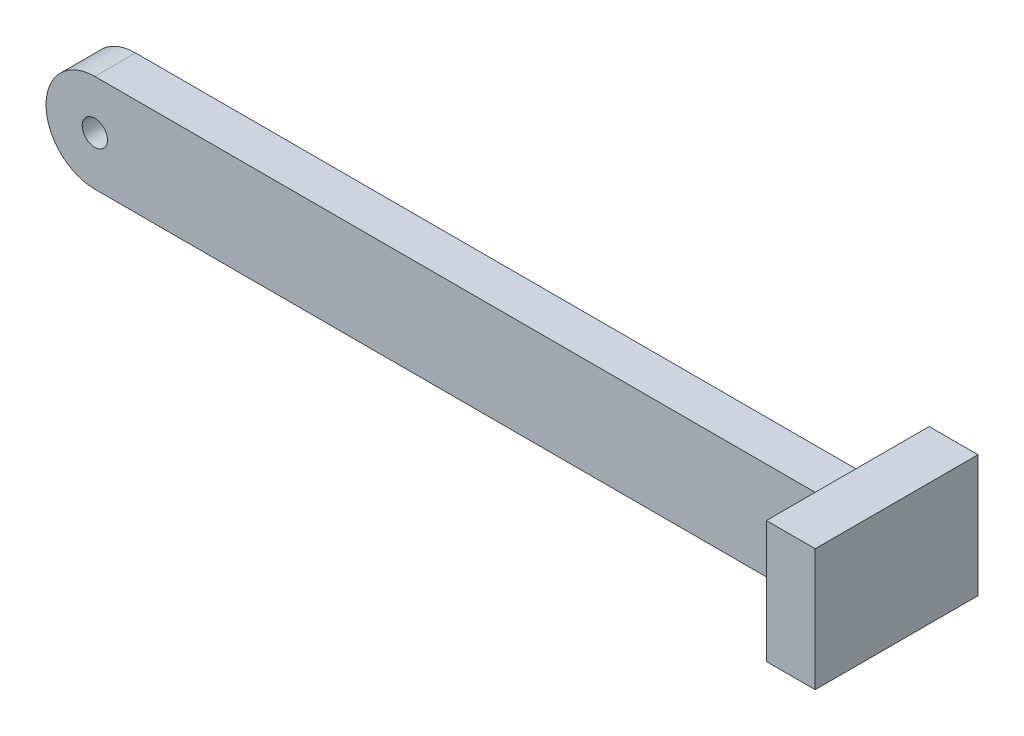
from build123d import *

# Parameters (mm, degrees)
SKETCH1_R           = 1.55
SKETCH1_R_2         = 1.5
BOSS_EXTRUDE1_DEPTH = 5
FILLET3_R           = 1
BOSS_EXTRUDE2_START = 7.5
SKETCH4_W           = 6
SKETCH4_H           = 15
BOSS_EXTRUDE2_DEPTH = 20


with BuildPart() as part:
    # Sketch1 → Boss-Extrude1 (new body)
    with BuildSketch(Plane.XY):
        with BuildLine():
            ThreePointArc((0, 6), (-6, 0), (0, -6))
            Line((0, -6), (90, -6))
            ThreePointArc((90, -6), (96, 0), (90, 6))
            Line((90, 6), (0, 6))
        make_face()
        Circle(SKETCH1_R, mode=Mode.SUBTRACT)
        with Locations((90, 0)):
            Circle(SKETCH1_R_2, mode=Mode.SUBTRACT)
    extrude(amount=BOSS_EXTRUDE1_DEPTH)

    # Fillet3
    fillet3_edges = [part.edges().sort_by_distance(p)[0] for p in [
        (88.5, 0, 0),
    ]]
    fillet(fillet3_edges, radius=FILLET3_R)

    # Sketch4 → Boss-Extrude2 (add)
    with BuildSketch(Plane.XY.offset(5).offset(BOSS_EXTRUDE2_START)):
        with Locations((93, 0)):
            Rectangle(SKETCH4_W, SKETCH4_H)
    extrude(amount=-BOSS_EXTRUDE2_DEPTH)


solid = part.part
